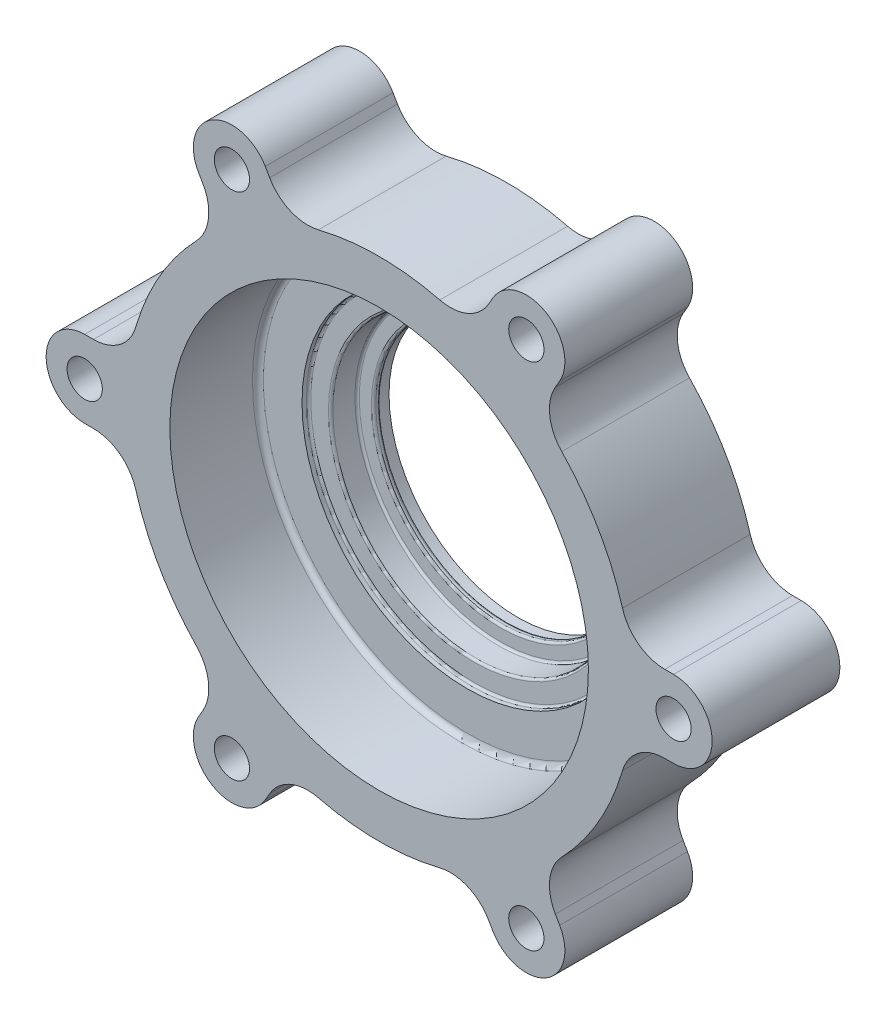
from build123d import *

# Parameters (mm, degrees)
SKETCH1_R           = 8
SKETCH1_R_2         = 95
BOSS_EXTRUDE1_DEPTH = 58
FILLET5_R           = 20
SKETCH1_3_R         = 95
SKETCH1_3_R_2       = 75
BOSS_EXTRUDE2_DEPTH = 18
FILLET1_R           = 2.5
SKETCH2_R           = 75
SKETCH2_R_2         = 65
BOSS_EXTRUDE3_DEPTH = 15
SKETCH2_3_R         = 75
SKETCH2_3_R_2       = 57.5
BOSS_EXTRUDE4_DEPTH = 3
FILLET3_R           = 1
FILLET7_R           = 1


with BuildPart() as part:
    # Sketch1 → Boss-Extrude1 (new body)
    with BuildSketch(Plane.XY):
        with BuildLine():
            Line((133.660679217, 17.5), (113.660679217, 17.5))
            ThreePointArc((113.660679217, 17.5), (99.592921435, 57.5), (71.985784175, 89.683035613))
            Line((71.985784175, 89.683035613), (81.985784175, 107.003543689))
            ThreePointArc((81.985784175, 107.003543689), (75.580339608, 130.908988255), (51.674895042, 124.503543689))
            Line((51.674895042, 124.503543689), (41.674895042, 107.183035613))
            ThreePointArc((41.674895042, 107.183035613), (0, 115), (-41.674895042, 107.183035613))
            Line((-41.674895042, 107.183035613), (-51.674895042, 124.503543689))
            ThreePointArc((-51.674895042, 124.503543689), (-75.580339608, 130.908988255), (-81.985784175, 107.003543689))
            Line((-81.985784175, 107.003543689), (-71.985784175, 89.683035613))
            ThreePointArc((-71.985784175, 89.683035613), (-99.592921435, 57.5), (-113.660679217, 17.5))
            Line((-113.660679217, 17.5), (-133.660679217, 17.5))
            ThreePointArc((-133.660679217, 17.5), (-151.160679217, 0), (-133.660679217, -17.5))
            Line((-133.660679217, -17.5), (-113.660679217, -17.5))
            ThreePointArc((-113.660679217, -17.5), (-99.592921435, -57.5), (-71.985784175, -89.683035613))
            Line((-71.985784175, -89.683035613), (-81.985784175, -107.003543689))
            ThreePointArc((-81.985784175, -107.003543689), (-75.580339608, -130.908988255), (-51.674895042, -124.503543689))
            Line((-51.674895042, -124.503543689), (-41.674895042, -107.183035613))
            ThreePointArc((-41.674895042, -107.183035613), (0, -115), (41.674895042, -107.183035613))
            Line((41.674895042, -107.183035613), (51.674895042, -124.503543689))
            ThreePointArc((51.674895042, -124.503543689), (75.580339608, -130.908988255), (81.985784175, -107.003543689))
            Line((81.985784175, -107.003543689), (71.985784175, -89.683035613))
            ThreePointArc((71.985784175, -89.683035613), (99.592921435, -57.5), (113.660679217, -17.5))
            Line((113.660679217, -17.5), (133.660679217, -17.5))
            ThreePointArc((133.660679217, -17.5), (151.160679217, 0), (133.660679217, 17.5))
        make_face()
        with Locations((133.660679217, 0)):
            Circle(SKETCH1_R, mode=Mode.SUBTRACT)
        Circle(SKETCH1_R_2, mode=Mode.SUBTRACT)
        with Locations((66.830339608, -115.753543689)):
            Circle(SKETCH1_R, mode=Mode.SUBTRACT)
        with Locations((-66.830339608, -115.753543689)):
            Circle(SKETCH1_R, mode=Mode.SUBTRACT)
        with Locations((-133.660679217, 0)):
            Circle(SKETCH1_R, mode=Mode.SUBTRACT)
        with Locations((-66.830339608, 115.753543689)):
            Circle(SKETCH1_R, mode=Mode.SUBTRACT)
        with Locations((66.830339608, 115.753543689)):
            Circle(SKETCH1_R, mode=Mode.SUBTRACT)
    extrude(amount=BOSS_EXTRUDE1_DEPTH)

    # Fillet5
    fillet5_edges = [part.edges().sort_by_distance(p)[0] for p in [
        (71.985784175, 89.683035613, 29),
        (41.674895042, 107.183035613, 29),
        (-41.674895042, 107.183035613, 29),
        (-71.985784175, 89.683035613, 29),
        (-113.660679217, 17.5, 29),
        (-113.660679217, -17.5, 29),
        (-71.985784175, -89.683035613, 29),
        (-41.674895042, -107.183035613, 29),
        (41.674895042, -107.183035613, 29),
        (71.985784175, -89.683035613, 29),
        (113.660679217, -17.5, 29),
        (113.660679217, 17.5, 29),
    ]]
    fillet(fillet5_edges, radius=FILLET5_R)

    # Sketch1<3> → Boss-Extrude2 (add)
    with BuildSketch(Plane.XY):
        Circle(SKETCH1_3_R)
        Circle(SKETCH1_3_R_2, mode=Mode.SUBTRACT)
    extrude(amount=BOSS_EXTRUDE2_DEPTH)

    # Fillet1
    fillet1_edges = [part.edges().sort_by_distance(p)[0] for p in [
        (-95, 0, 18),
    ]]
    fillet(fillet1_edges, radius=FILLET1_R)

    # Sketch2 → Boss-Extrude3 (add)
    with BuildSketch(Plane(origin=(0, 0, 0), x_dir=(-1, 0, 0), z_dir=(0, 0, -1))):
        Circle(SKETCH2_R)
        Circle(SKETCH2_R_2, mode=Mode.SUBTRACT)
    extrude(amount=-BOSS_EXTRUDE3_DEPTH)

    # Sketch2<3> → Boss-Extrude4 (add)
    with BuildSketch(Plane(origin=(0, 0, 0), x_dir=(-1, 0, 0), z_dir=(0, 0, -1))):
        Circle(SKETCH2_3_R)
        Circle(SKETCH2_3_R_2, mode=Mode.SUBTRACT)
    extrude(amount=-BOSS_EXTRUDE4_DEPTH)

    # Fillet3
    fillet3_edges = [part.edges().sort_by_distance(p)[0] for p in [
        (-75, 0, 15),
        (65, 0, 15),
        (57.5, 0, 0),
        (57.5, 0, 3),
        (65, 0, 3),
    ]]
    fillet(fillet3_edges, radius=FILLET3_R)

    # Sketch9 → Revolve1 (revolve)
    with BuildSketch(Plane(origin=(0, 0, 0), x_dir=(1, 0, 0), z_dir=(0, 1, 0))):
        Polygon((-58.5, 0), (-58.5, 5), (-63.5, 5), (-68.5, 0), align=None)
    revolve(axis=Axis((0, 0, -8.15), (0, 0, 1)))

    # Fillet7
    fillet7_edges = [part.edges().sort_by_distance(p)[0] for p in [
        (63.5, 0, -5),
    ]]
    fillet(fillet7_edges, radius=FILLET7_R)


solid = part.part
